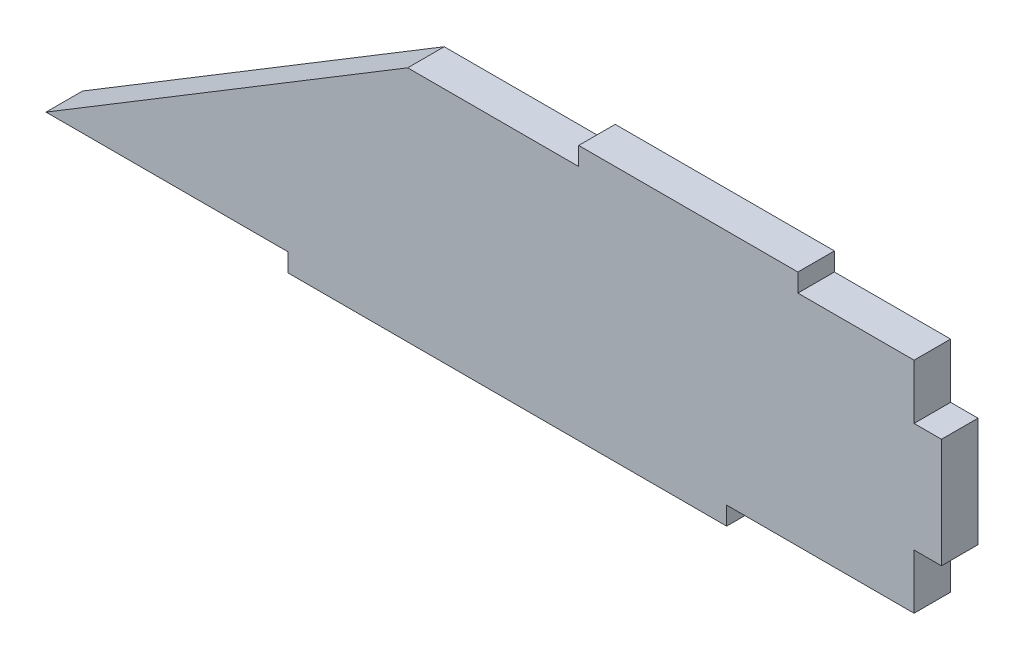
from build123d import *

# Parameters (mm, degrees)
BOSS_EXTRUDE1_DEPTH = 12.7


with BuildPart() as part:
    # Sketch1 → Boss-Extrude1 (new body)
    with BuildSketch(Plane.XY):
        Polygon((138.880411235, 35.070810918), (98.494411235, 35.070810918), (98.494411235, 41.420810918), (22.294411235, 41.420810918), (22.294411235, 35.070810918), (-37.141588765, 35.070810918), (-162.871588765, -41.129189082), (-78.670588765, -41.129189082), (-78.670588765, -47.479189082), (73.729411235, -47.479189082), (73.729411235, -41.129189082), (138.880411235, -41.129189082), (138.880411235, -22.079189082), (148.405411235, -22.079189082), (148.405411235, 16.020810918), (138.880411235, 16.020810918), align=None)
    extrude(amount=BOSS_EXTRUDE1_DEPTH)


solid = part.part
